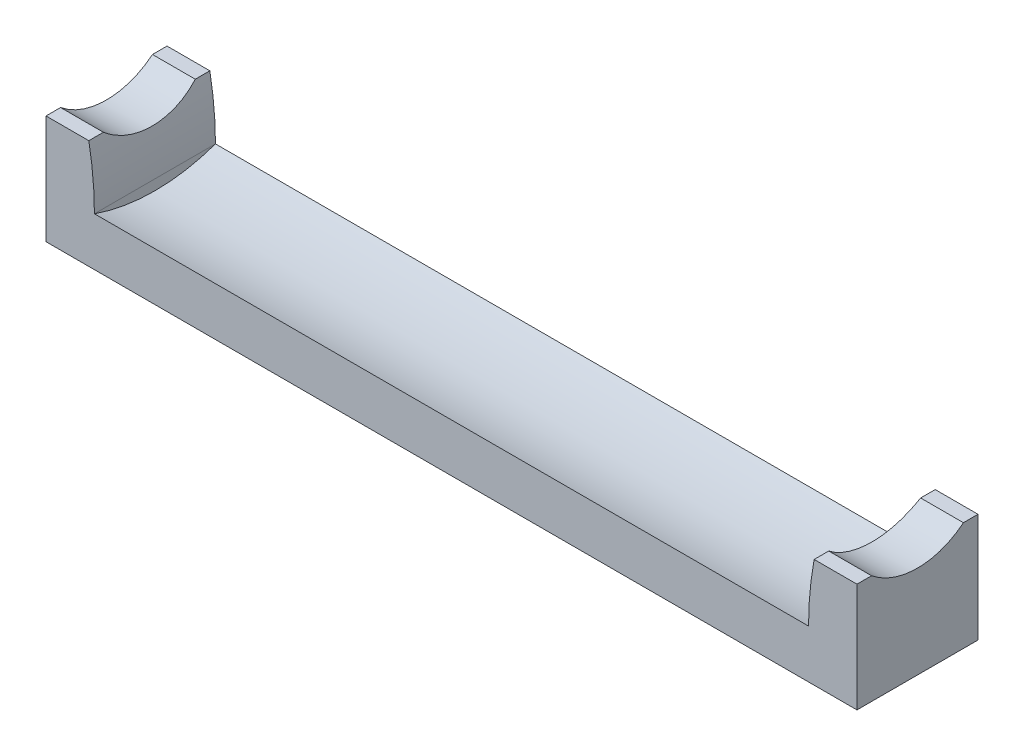
from build123d import *

# Parameters (mm, degrees)
RESSALTO_EXTRUS_O1_DEPTH = 20
CORTE_EXTRUS_O1_DEPTH    = 118
CORTE_EXTRUS_O2_DEPTH    = 137.674796506
ESBO_O4_R                = 11.969366969
CORTE_EXTRUS_O3_DEPTH    = 137.674796506


with BuildPart() as part:
    # Esboço1 → Ressalto-extrusão1 (new body)
    with BuildSketch(Plane.XY):
        Polygon((0, 0), (0, 18), (8, 18), (8, 8), (126, 8), (126, 18), (134, 18), (134, 0), align=None)
    extrude(amount=RESSALTO_EXTRUS_O1_DEPTH)

    # Esboço2 → Corte-extrusão1 (cut)
    with BuildSketch(Plane(origin=(8, 0, 0), x_dir=(0, 0, -1), z_dir=(1, 0, 0))):
        with BuildLine():
            Line((-20, 8), (0, 8))
            ThreePointArc((0, 8), (-10, 6.284271247), (-20, 8))
        make_face()
    extrude(amount=CORTE_EXTRUS_O1_DEPTH, mode=Mode.SUBTRACT)

    # Esboço3 → Corte-extrusão2 (cut, through all)
    with BuildSketch(Plane(origin=(0, 0, 0), x_dir=(-1, 0, 0), z_dir=(0, 0, -1))):
        with BuildLine():
            Line((-8, 18), (-7.073837994, 18))
            ThreePointArc((-7.073837994, 18), (-7.767965092, 13.021398611), (-8, 8))
            Line((-8, 8), (-8, 18))
        make_face()
        with BuildLine():
            Line((-126, 8), (-126, 18))
            Line((-126, 18), (-126.926162006, 18))
            ThreePointArc((-126.926162006, 18), (-126.232034908, 13.021398611), (-126, 8))
        make_face()
    extrude(amount=-CORTE_EXTRUS_O2_DEPTH, mode=Mode.SUBTRACT)

    # Esboço4 → Corte-extrusão3 (cut, through all)
    with BuildSketch(Plane.ZY):
        with Locations((10, 27.253795072)):
            Circle(ESBO_O4_R)
    extrude(amount=-CORTE_EXTRUS_O3_DEPTH, mode=Mode.SUBTRACT)


solid = part.part
